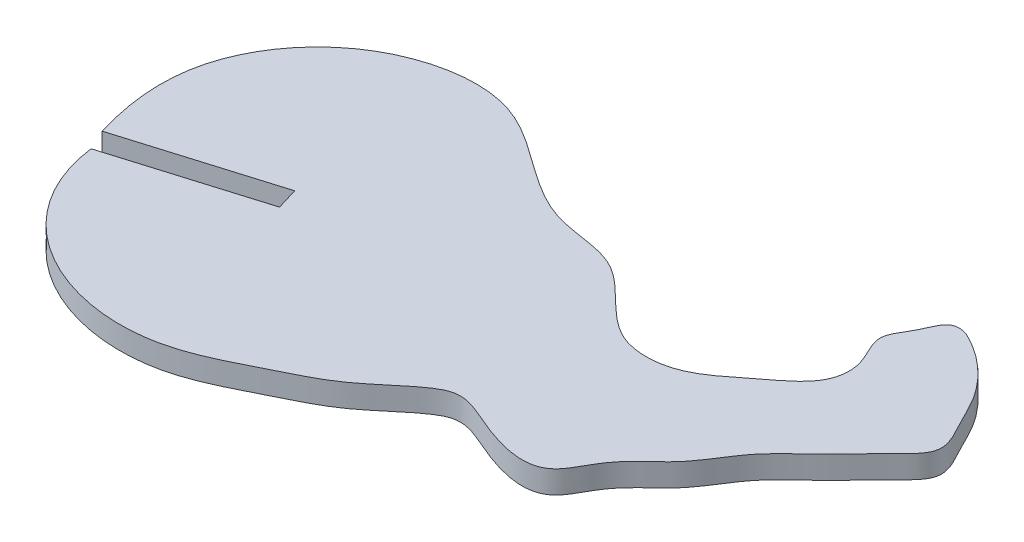
from build123d import *

# Parameters (mm, degrees)
EXTRUDE_1_DEPTH = 4


with BuildPart() as part:
    # Эскиз1 → Бобышка-Вытянуть1 (new body)
    with BuildSketch(Plane(origin=(0, 0, 0), x_dir=(1, 0, 0), z_dir=(0, 1, 0))):
        with BuildLine():
            Line((247.741835852, 47.874869006), (273.786081968, 55.729630826))
            Line((273.786081968, 55.729630826), (274.941069086, 51.900008813))
            Line((274.941069086, 51.900008813), (249.445655619, 44.210771069))
            add(Edge.make_bspline(
                [(354.758784134, 92.955509874), (358.916690971, 91.021761105), (364.347560567, 86.228061254), (367.730208942, 78.668715766), (371.305704515, 72.72938285), (365.589270963, 67.663402352), (360.782605143, 62.075225194), (353.818613111, 56.347442619), (349.500951456, 47.802309252), (342.527875727, 43.004841238), (338.466727575, 32.497794809), (327.166765998, 36.220707194), (319.352329821, 40.043962424), (313.075148165, 35.872262433), (307.542077601, 30.444288243), (297.456861123, 25.695547138), (276.599097952, 14.486263778), (251.932813617, 25.603732039), (249.445655619, 44.210771069)],
                knots=[0, 0, 0, 0, 0.078226861, 0.111117024, 0.144606674, 0.176640659, 0.220998653, 0.274641372, 0.323696475, 0.377440298, 0.414710463, 0.490239592, 0.528816774, 0.552954784, 0.607498644, 0.661115586, 0.737272048, 1, 1, 1, 1], degree=3))
            add(Edge.make_bspline(
                [(354.758784134, 92.955509874), (351.264618647, 94.231244124), (350.623400977, 89.775222798), (346.461727609, 84.713572716), (350.205187422, 79.95959348), (350.136111936, 72.763272085), (342.566986953, 67.624134973), (335.516611303, 61.258189163), (322.158981941, 60.965995587), (315.198127234, 73.913145143), (296.070557929, 73.726875181), (282.361557353, 91.269034749), (256.776729947, 85.800678741), (244.063484397, 67.47123045), (245.876786144, 54.058864744), (247.741835852, 47.874869006)],
                knots=[0, 0, 0, 0, 0.04296283, 0.070836361, 0.107604324, 0.135122077, 0.193651049, 0.257760145, 0.308073163, 0.41183075, 0.47823955, 0.630858656, 0.762731243, 0.887118401, 1, 1, 1, 1], degree=3))
        make_face()
    extrude(amount=EXTRUDE_1_DEPTH)


solid = part.part
